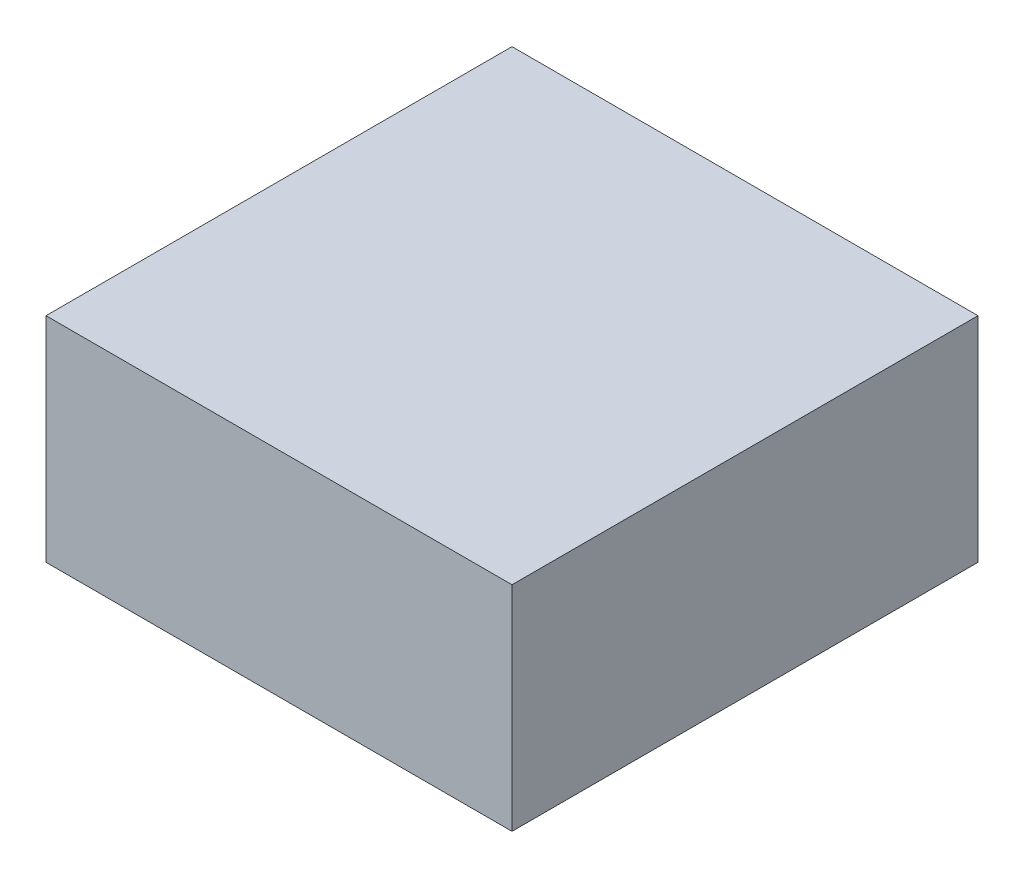
from build123d import *

# Parameters (mm, degrees)
SKETCH1_W           = 12
SKETCH1_H           = 12
BOSS_EXTRUDE1_DEPTH = 5.5
SKETCH2_W           = 11
SKETCH2_H           = 11
CUT_EXTRUDE1_DEPTH  = 5
SKETCH3_W           = 4.8
SKETCH3_H           = 4.8
BOSS_EXTRUDE2_DEPTH = 2.2
SKETCH4_W           = 0.5
SKETCH4_H           = 3.8
BOSS_EXTRUDE3_DEPTH = 2.8
SKETCH5_W           = 0.5
SKETCH5_H           = 3.8
BOSS_EXTRUDE4_DEPTH = 2.8


with BuildPart() as part:
    # Sketch1 → Boss-Extrude1 (new body)
    with BuildSketch(Plane(origin=(0, 0, 0), x_dir=(1, 0, 0), z_dir=(0, 1, 0))):
        Rectangle(SKETCH1_W, SKETCH1_H)
    extrude(amount=-BOSS_EXTRUDE1_DEPTH)

    # Sketch2 → Cut-Extrude1 (cut)
    with BuildSketch(Plane.XZ.offset(5.5)):
        Rectangle(SKETCH2_W, SKETCH2_H)
    extrude(amount=-CUT_EXTRUDE1_DEPTH, mode=Mode.SUBTRACT)

    # Sketch3 → Boss-Extrude2 (add)
    with BuildSketch(Plane.XZ.offset(0.5)):
        Rectangle(SKETCH3_W, SKETCH3_H)
    extrude(amount=BOSS_EXTRUDE2_DEPTH)

    # Sketch4 → Boss-Extrude3 (add)
    with BuildSketch(Plane.XZ.offset(2.7)):
        with Locations((-2.15, 0)):
            Rectangle(SKETCH4_W, SKETCH4_H)
    extrude(amount=BOSS_EXTRUDE3_DEPTH)

    # Sketch5 → Boss-Extrude4 (add)
    with BuildSketch(Plane.XZ.offset(2.7)):
        with Locations((2.15, 0)):
            Rectangle(SKETCH5_W, SKETCH5_H)
    extrude(amount=BOSS_EXTRUDE4_DEPTH)


solid = part.part
